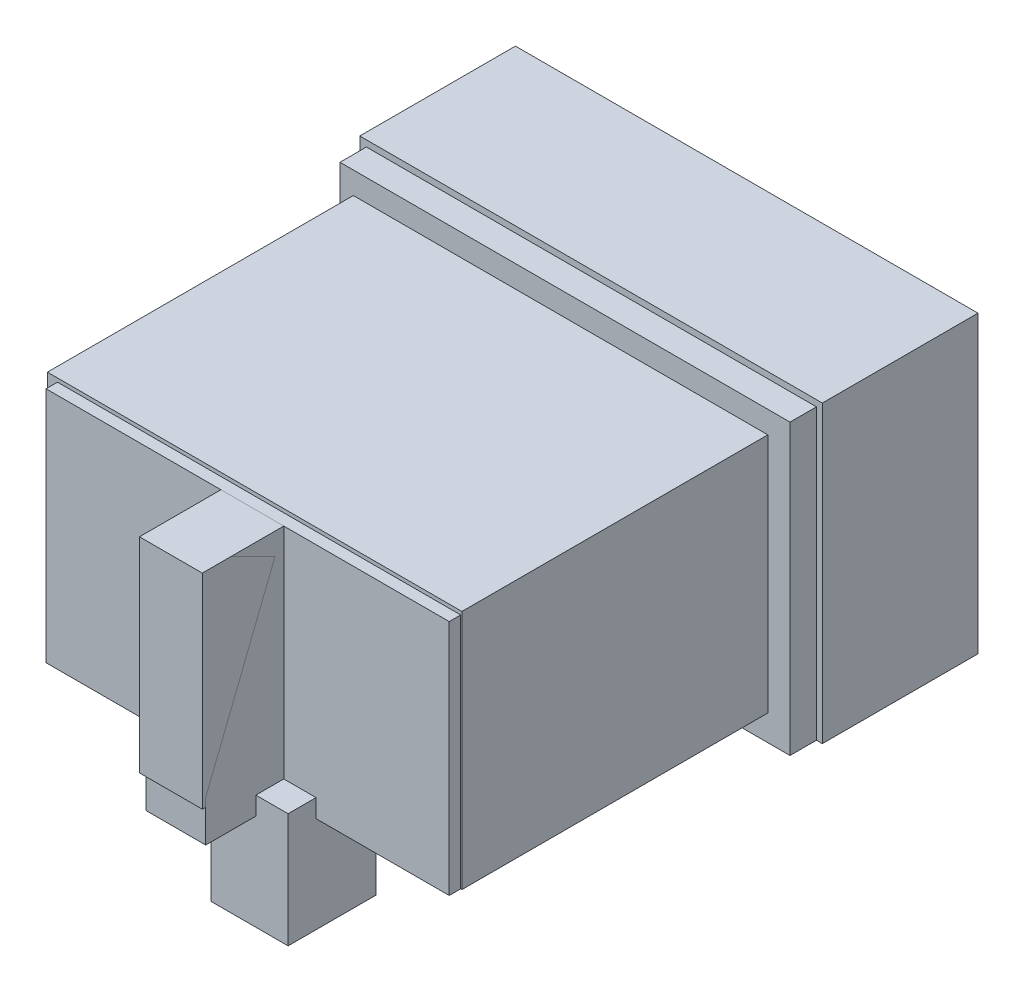
from build123d import *

# Parameters (mm, degrees)
SCHIZZO1_W                        = 865
SCHIZZO1_H                        = 555
ESTRUSIONE_ESTRUSIONE1_DEPTH      = 350
SCHIZZO2_W                        = 775
SCHIZZO2_H                        = 456
ESTRUSIONE_ESTRUSIONE2_DEPTH      = 610
SCHIZZO3_W                        = 115
SCHIZZO3_H                        = 456
ESTRUSIONE_ESTRUSIONE3_DEPTH      = 150
ESTRUSIONE_ESTRUSIONE4_DEPTH      = 185
ESTRUSIONE_ESTRUSIONE4_DEPTH_BACK = 30
SCHIZZO4_W                        = 140
SCHIZZO4_H                        = 165
SCHIZZO5_W                        = 889.020655165
SCHIZZO5_H                        = 299.196711451
ESTRUSIONE_ESTRUSIONE5_DEPTH      = 567
SCHIZZO6_W                        = 796.680903304
SCHIZZO6_H                        = 587.968632113
ESTRUSIONE_ESTRUSIONE6_DEPTH      = 463
SCHIZZO7_W                        = 148.139846742
SCHIZZO7_H                        = 168.706943007
ESTRUSIONE_ESTRUSIONE7_DEPTH      = 220
SCHIZZO8_W                        = 120.787004933
SCHIZZO8_H                        = 156.583617578
ESTRUSIONE_ESTRUSIONE8_DEPTH      = 393


with BuildPart() as part:
    # Schizzo1 → Estrusione-Estrusione1 (new body)
    with BuildSketch(Plane.XY):
        Rectangle(SCHIZZO1_W, SCHIZZO1_H)
    extrude(amount=-ESTRUSIONE_ESTRUSIONE1_DEPTH)


with BuildPart() as body_2:
    # Schizzo2 → Estrusione-Estrusione2 (new body)
    with BuildSketch(Plane.XY):
        Rectangle(SCHIZZO2_W, SCHIZZO2_H)
    extrude(amount=ESTRUSIONE_ESTRUSIONE2_DEPTH)


with BuildPart() as body_3:
    # Schizzo3 → Estrusione-Estrusione3 (new body)
    with BuildSketch(Plane.XY.offset(610)):
        with Locations((12, 0)):
            Rectangle(SCHIZZO3_W, SCHIZZO3_H)
    extrude(amount=ESTRUSIONE_ESTRUSIONE3_DEPTH)


with BuildPart() as body_4:
    # Schizzo4 → Estrusione-Estrusione4 (new, two sides: drawn at the far end of the back side and taken through both)
    with BuildSketch(Plane(origin=(0, -228, 0), x_dir=(-1, 0, 0), z_dir=(0, -1, 0)).offset(-ESTRUSIONE_ESTRUSIONE4_DEPTH_BACK)):
        with Locations((-57.5, -577.5)):
            Rectangle(SCHIZZO4_W, SCHIZZO4_H)
    extrude(amount=ESTRUSIONE_ESTRUSIONE4_DEPTH + ESTRUSIONE_ESTRUSIONE4_DEPTH_BACK)


with BuildPart() as body_5:
    # Schizzo5 → Estrusione-Estrusione5 (new body)
    with BuildSketch(Plane(origin=(0, -277.5, 0), x_dir=(-1, 0, 0), z_dir=(0, -1, 0))):
        with Locations((0.702831723, 200.401644275)):
            Rectangle(SCHIZZO5_W, SCHIZZO5_H)
    extrude(amount=-ESTRUSIONE_ESTRUSIONE5_DEPTH)


with BuildPart() as body_6:
    # Schizzo6 → Estrusione-Estrusione6 (new body)
    with BuildSketch(Plane(origin=(0, -228, 0), x_dir=(-1, 0, 0), z_dir=(0, -1, 0))):
        with Locations((8.494274834, -293.984316057)):
            Rectangle(SCHIZZO6_W, SCHIZZO6_H)
    extrude(amount=-ESTRUSIONE_ESTRUSIONE6_DEPTH)


with BuildPart() as body_7:
    # Schizzo7 → Estrusione-Estrusione7 (new body)
    with BuildSketch(Plane(origin=(0, -413, 0), x_dir=(-1, 0, 0), z_dir=(0, -1, 0))):
        with Locations((-57.43485811, -579.353471504)):
            Rectangle(SCHIZZO7_W, SCHIZZO7_H)
    extrude(amount=-ESTRUSIONE_ESTRUSIONE7_DEPTH)


with BuildPart() as body_8:
    # Schizzo8 → Estrusione-Estrusione8 (new body)
    with BuildSketch(Plane(origin=(0, 228, 0), x_dir=(1, 0, 0), z_dir=(0, 1, 0))):
        with Locations((9.106497533, -688.291808789)):
            Rectangle(SCHIZZO8_W, SCHIZZO8_H)
    extrude(amount=-ESTRUSIONE_ESTRUSIONE8_DEPTH)


solid = Compound([part.part, body_2.part, body_3.part, body_4.part, body_5.part, body_6.part, body_7.part, body_8.part])
